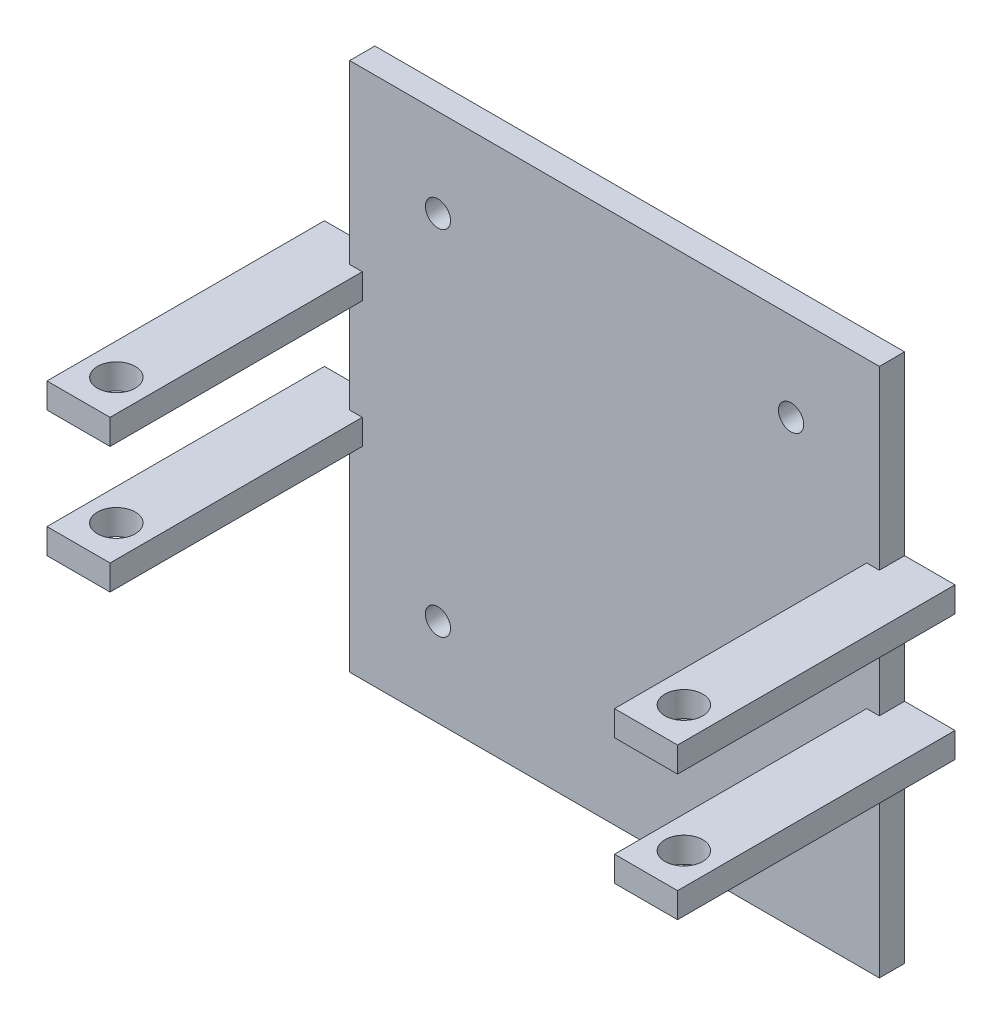
from build123d import *

# Parameters (mm, degrees)
SKETCH_1_W                  = 42
SKETCH_1_H                  = 42
EXTRUDE_1_DEPTH             = 2
SKETCH_2_R                  = 1
CUT_EXTRUDE_2_DEPTH         = 33.61880943
PATTERN_LINEAR_1_COUNT      = 2
PATTERN_LINEAR_1_PITCH      = 28
PATTERN_LINEAR_1_COUNT_DIR2 = 2
PATTERN_LINEAR_1_PITCH_DIR2 = 28
EXTRUDE_START               = -2
SKETCH_4_W                  = 50
SKETCH_4_H                  = 2
EXTRUDE_2_DEPTH             = 22
SKETCH_7_W                  = 40
SKETCH_7_H                  = 2
CUT_EXTRUDE_3_DEPTH         = 20
PATTERN_LINEAR_2_COUNT      = 2
PATTERN_LINEAR_2_PITCH      = 10
SKETCH_8_R                  = 1.5
CUT_EXTRUDE_4_DEPTH         = 44.995814029
PATTERN_LINEAR_3_COUNT      = 4
PATTERN_LINEAR_3_PITCH      = 5
PATTERN_LINEAR_3_COUNT_DIR2 = 2
PATTERN_LINEAR_3_PITCH_DIR2 = 45


with BuildPart() as part:
    # 草图1 → 凸台-拉伸1 (new body)
    with BuildSketch(Plane.XY):
        with Locations((-0.838569079, -3.146710526)):
            Rectangle(SKETCH_1_W, SKETCH_1_H)
    extrude(amount=EXTRUDE_1_DEPTH)

    # 草图2 → 切除-拉伸2 (cut, through all)
    with BuildSketch(Plane.XY.offset(2)):
        with Locations((-14.838569079, 10.853289474)):
            Circle(SKETCH_2_R)
    cut_extrude_2 = extrude(amount=-CUT_EXTRUDE_2_DEPTH, mode=Mode.SUBTRACT)

    # 阵列(线性)1: Cut-Extrude 2 2 × 2
    with Locations(*[(j * PATTERN_LINEAR_1_PITCH_DIR2, -i * PATTERN_LINEAR_1_PITCH, 0) for i in range(PATTERN_LINEAR_1_COUNT) for j in range(PATTERN_LINEAR_1_COUNT_DIR2) if (i, j) != (0, 0)]):
        add(cut_extrude_2, mode=Mode.SUBTRACT)

    # 草图4 → 凸台-拉伸2 (add)
    with BuildSketch(Plane.XY.offset(2).offset(EXTRUDE_START)):
        with Locations((-0.838569079, 2.853289474)):
            Rectangle(SKETCH_4_W, SKETCH_4_H)
    extrude_2 = extrude(amount=EXTRUDE_2_DEPTH)

    # 草图7 → 切除-拉伸3 (cut)
    with BuildSketch(Plane.XY.offset(22)):
        with Locations((-0.838569079, 2.853289474)):
            Rectangle(SKETCH_7_W, SKETCH_7_H)
    cut_extrude_3 = extrude(amount=-CUT_EXTRUDE_3_DEPTH, mode=Mode.SUBTRACT)

    # 阵列(线性)2: 凸台-拉伸2, 切除-拉伸3 ×2
    with Locations(*[(0, -i * PATTERN_LINEAR_2_PITCH, 0) for i in range(1, PATTERN_LINEAR_2_COUNT)]):
        add(extrude_2)
        add(cut_extrude_3, mode=Mode.SUBTRACT)

    # 草图8 → 切除-拉伸4 (cut, through all)
    with BuildSketch(Plane(origin=(0, 3.853289474, 0), x_dir=(1, 0, 0), z_dir=(0, 1, 0))):
        with Locations(Location((-23.338569079, -19, 0), (0, 0, 270))):
            Circle(SKETCH_8_R)
    cut_extrude_4 = extrude(amount=-CUT_EXTRUDE_4_DEPTH, mode=Mode.SUBTRACT)

    # 阵列(线性)3: Cut-Extrude 4 4 × 2
    with Locations(*[(j * PATTERN_LINEAR_3_PITCH_DIR2, 0, i * PATTERN_LINEAR_3_PITCH) for i in range(PATTERN_LINEAR_3_COUNT) for j in range(PATTERN_LINEAR_3_COUNT_DIR2) if (i, j) != (0, 0)]):
        add(cut_extrude_4, mode=Mode.SUBTRACT)


solid = part.part
